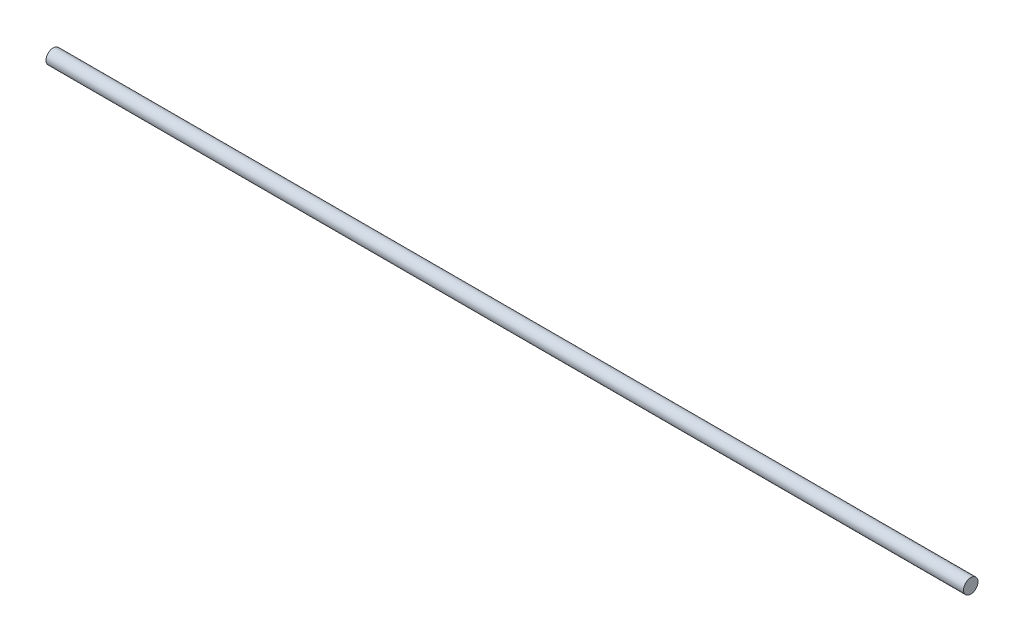
from build123d import *

# Parameters (mm, degrees)
CROQUIS1_R              = 2.5
SALIENTE_EXTRUIR1_DEPTH = 158.765


with BuildPart() as part:
    # Croquis1 → Saliente-Extruir1 (new, symmetric)
    with BuildSketch(Plane(origin=(0, 0, 0), x_dir=(0, 0, -1), z_dir=(1, 0, 0))):
        Circle(CROQUIS1_R)
    extrude(amount=SALIENTE_EXTRUIR1_DEPTH, both=True)


solid = part.part
